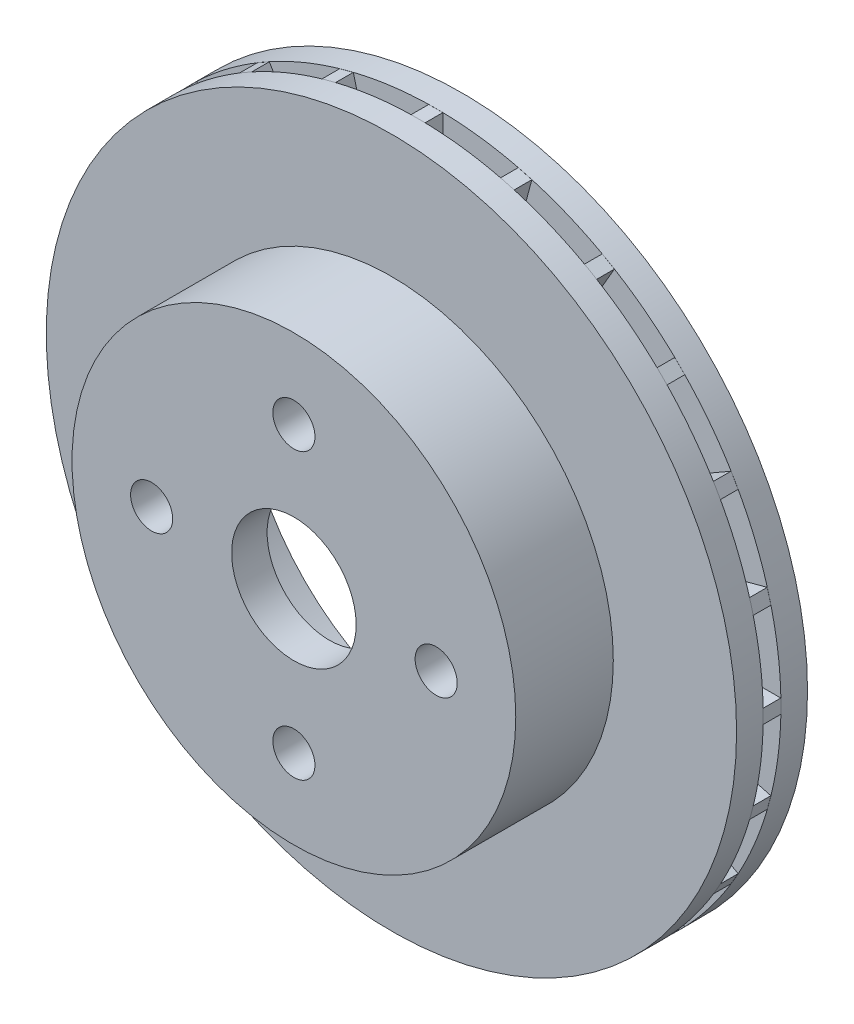
from build123d import *

# Parameters (mm, degrees)
SKETCH1_R          = 38.928100528
SKETCH1_R_2        = 25.022354689
EXTRUDE1_DEPTH     = 3
SKETCH2_W          = 13.898513907
SKETCH2_H          = 1.587850138
EXTRUDE2_DEPTH     = 2
CIRPATTERN1_COUNT  = 24
LPATTERN1_COUNT    = 2
LPATTERN1_PITCH    = 5
EXTRUDE3_START     = -3
SKETCH3_R          = 25.022354689
SKETCH3_R_2        = 22.022354689
EXTRUDE3_DEPTH     = 14
EXTRUDE4_START     = -4
SKETCH4_R          = 22.022354689
SKETCH4_R_2        = 7.022354689
EXTRUDE4_DEPTH     = 4
SKETCH5_R          = 2.374357642
CUT_EXTRUDE1_DEPTH = 4
CIRPATTERN2_COUNT  = 4


with BuildPart() as part:
    # Sketch1 → Extrude1 (new body)
    with BuildSketch(Plane.XY):
        Circle(SKETCH1_R)
        Circle(SKETCH1_R_2, mode=Mode.SUBTRACT)
    extrude1 = extrude(amount=EXTRUDE1_DEPTH)

    # Sketch2 → Extrude2 (add)
    with BuildSketch(Plane.XY.offset(3)):
        with Locations((31.965311014, 0)):
            Rectangle(SKETCH2_W, SKETCH2_H)
    extrude2 = extrude(amount=EXTRUDE2_DEPTH)

    # CirPattern1: Extrude2 ×24 about axis
    cirpattern1_axis = Axis((0, 0, 0), (0, 0, 1))
    for i in range(1, CIRPATTERN1_COUNT):
        add(extrude2.rotate(cirpattern1_axis, i * 360 / CIRPATTERN1_COUNT))

    # LPattern1: Extrude1 ×2
    with Locations(*[(0, 0, i * LPATTERN1_PITCH) for i in range(1, LPATTERN1_COUNT)]):
        add(extrude1)

    # Sketch3 → Extrude3 (add)
    with BuildSketch(Plane.XY.offset(8).offset(EXTRUDE3_START)):
        with Locations(Location((0, 0, 0), (0, 0, 181.285803534))):
            Circle(SKETCH3_R)
        Circle(SKETCH3_R_2, mode=Mode.SUBTRACT)
    extrude(amount=EXTRUDE3_DEPTH)

    # Sketch4 → Extrude4 (add)
    with BuildSketch(Plane.XY.offset(19).offset(EXTRUDE4_START)):
        Circle(SKETCH4_R)
        Circle(SKETCH4_R_2, mode=Mode.SUBTRACT)
    extrude(amount=EXTRUDE4_DEPTH)

    # Sketch5 → Cut-Extrude1 (cut)
    with BuildSketch(Plane.XY.offset(19)):
        with Locations((0, 16.045543099)):
            Circle(SKETCH5_R)
    cut_extrude1 = extrude(amount=-CUT_EXTRUDE1_DEPTH, mode=Mode.SUBTRACT)

    # CirPattern2: Cut-Extrude1 ×4 about axis
    cirpattern2_axis = Axis((0, 0, 0), (0, 0, 1))
    for i in range(1, CIRPATTERN2_COUNT):
        add(cut_extrude1.rotate(cirpattern2_axis, i * 360 / CIRPATTERN2_COUNT), mode=Mode.SUBTRACT)


solid = part.part
